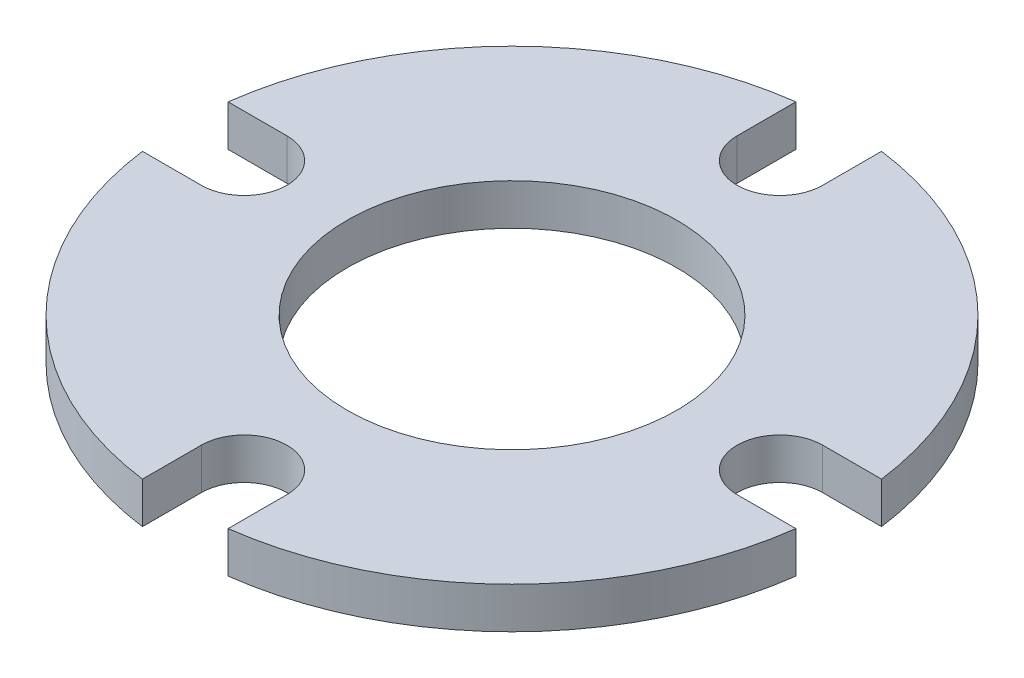
from build123d import *

# Parameters (mm, degrees)
BOSS_EXTRUDE1_DEPTH = 1.5875
HOLE1_D             = 25.4


with BuildPart() as part:
    # Sketch2 → Boss-Extrude1 (new, symmetric)
    with BuildSketch(Plane(origin=(0, 0, 0), x_dir=(1, 0, 0), z_dir=(0, 1, 0))):
        with BuildLine():
            Line((20.6502, 3.302), (25.184455444, 3.302))
            ThreePointArc((25.184455444, 3.302), (17.960512242, 17.960512242), (3.302, 25.184455444))
            Line((3.302, 25.184455444), (3.302, 20.6502))
            ThreePointArc((3.302, 20.6502), (0, 17.3482), (-3.302, 20.6502))
            Line((-3.302, 20.6502), (-3.302, 25.184455444))
            ThreePointArc((-3.302, 25.184455444), (-17.960512242, 17.960512242), (-25.184455444, 3.302))
            Line((-25.184455444, 3.302), (-20.6502, 3.302))
            ThreePointArc((-20.6502, 3.302), (-17.3482, 0), (-20.6502, -3.302))
            Line((-20.6502, -3.302), (-25.184455444, -3.302))
            ThreePointArc((-25.184455444, -3.302), (-17.960512242, -17.960512242), (-3.302, -25.184455444))
            Line((-3.302, -25.184455444), (-3.302, -20.6502))
            ThreePointArc((-3.302, -20.6502), (0, -17.3482), (3.302, -20.6502))
            Line((3.302, -20.6502), (3.302, -25.184455444))
            ThreePointArc((3.302, -25.184455444), (17.960512242, -17.960512242), (25.184455444, -3.302))
            Line((25.184455444, -3.302), (20.6502, -3.302))
            ThreePointArc((20.6502, -3.302), (17.3482, 0), (20.6502, 3.302))
        make_face()
    extrude(amount=BOSS_EXTRUDE1_DEPTH, both=True)

    # Hole1 (through all)
    with Locations(Plane(origin=(0, 1.5875, 0), x_dir=(1, 0, 0), z_dir=(0, 1, 0))):
        with Locations((0, 0)):
            Hole(HOLE1_D / 2)


solid = part.part
